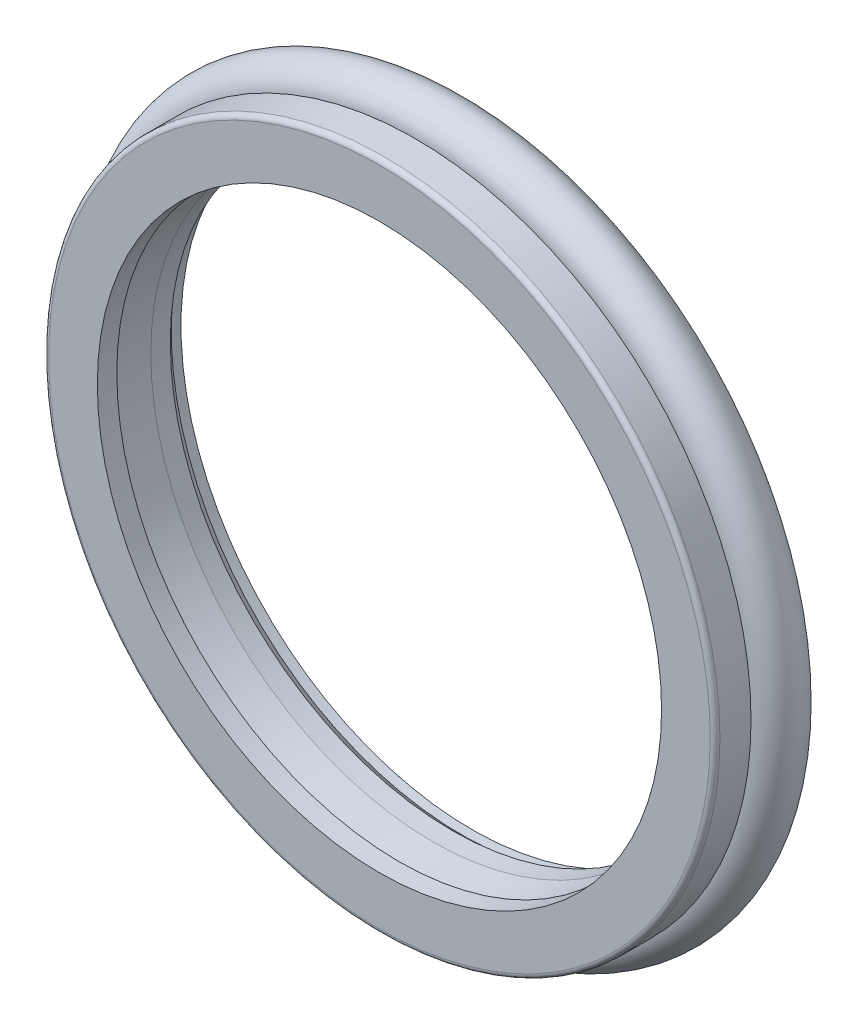
from build123d import *

# Parameters (mm, degrees)
SKETCH2_R = 1.3


with BuildPart() as part:
    # Sketch1 → Revolve1 (revolve)
    with BuildSketch(Plane(origin=(0, 0, 0), x_dir=(0, 0, -1), z_dir=(1, 0, 0)), mode=Mode.PRIVATE) as revolve1_sk:
        with BuildLine():
            Line((0.25, 17.25), (1.85, 17.25))
            Line((1.85, 17.25), (1.85, 15.75))
            Line((1.85, 15.75), (4.75, 15.75))
            Line((4.75, 15.75), (4.75, 14.95))
            Line((4.75, 14.95), (4.25, 14.95))
            Line((4.25, 14.95), (3.75, 14.5))
            Line((3.75, 14.5), (2.75, 14.5))
            Line((2.75, 14.5), (1, 14.7))
            Line((1, 14.7), (1, 14.5))
            Line((1, 14.5), (0, 14.5))
            Line((0, 14.5), (0, 17))
            ThreePointArc((0, 17), (0.073223305, 17.176776695), (0.25, 17.25))
        make_face()
    revolve(revolve1_sk.sketch.rotate(Axis((0, 0, 0), (0, 0, -1)), 90), axis=Axis((0, 0, 0), (0, 0, -1)))


with BuildPart() as body_2:
    # Sketch2 → Revolve2 (revolve)
    with BuildSketch(Plane(origin=(0, 0, 0), x_dir=(0, 0, -1), z_dir=(1, 0, 0)), mode=Mode.PRIVATE) as revolve2_sk:
        with Locations((3.3, 17.05)):
            Circle(SKETCH2_R)
    revolve(revolve2_sk.sketch.rotate(Axis((0, 0, 0), (0, 0, -1)), 270), axis=Axis((0, 0, 0), (0, 0, -1)))


solid = Compound([part.part, body_2.part])
